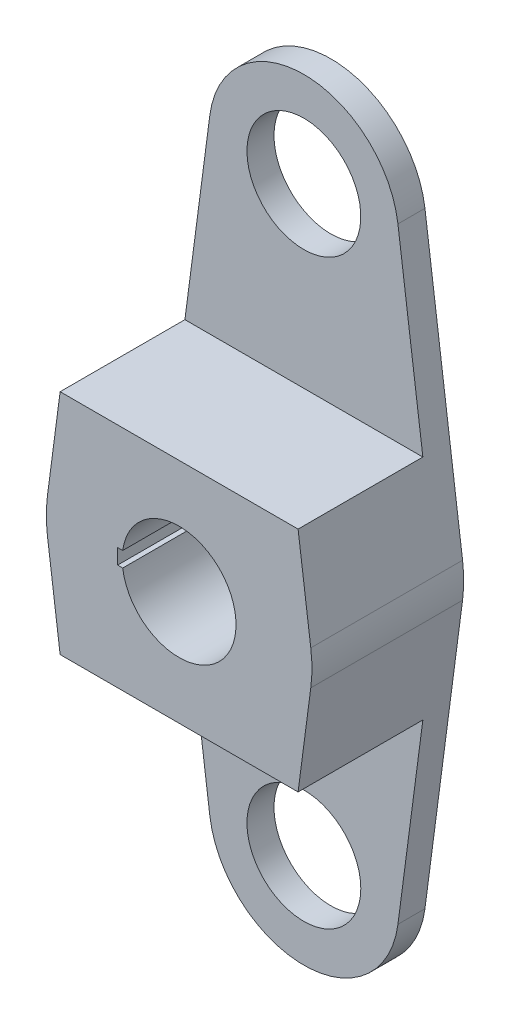
from build123d import *
from build123d.topology import SkipClean

# Parameters (mm, degrees)
BOSS_EXTRUDE1_DEPTH = 3.175
BOSS_EXTRUDE2_START = 3.175
SKETCH2_R           = 3.175
BOSS_EXTRUDE2_DEPTH = 3.175
SKETCH3_R           = 4.7625
BOSS_EXTRUDE3_DEPTH = 6.35
BOSS_EXTRUDE4_START = 3.175
SKETCH4_R           = 4.7625
BOSS_EXTRUDE4_DEPTH = 3.175
CUT_EXTRUDE1_START  = -4.0894
CUT_EXTRUDE1_DEPTH  = 4.0894
SKETCH6_W           = 0.762
SKETCH6_H           = 1.27
CUT_EXTRUDE2_DEPTH  = 9.525


with BuildPart() as part:
    # Sketch1 → Boss-Extrude1 (new body)
    with BuildSketch(Plane.XY):
        with BuildLine():
            Line((11.017558073, 1.449506939), (7.869684338, 25.3761821))
            ThreePointArc((7.869684338, 25.3761821), (7.920527939, 24.859610334), (7.9375, 24.34082))
            ThreePointArc((7.9375, 24.34082), (5.612660076, 18.728159924), (0, 16.40332))
            Line((0, 16.40332), (0, 11.1125))
            ThreePointArc((0, 11.1125), (7.327346395, 8.354498851), (11.017558073, 1.449506939))
        make_face()
        with BuildLine():
            ThreePointArc((7.9375, 24.34082), (7.920527939, 24.859610334), (7.869684338, 25.3761821))
            ThreePointArc((7.869684338, 25.3761821), (5.233818854, 30.30831918), (0, 32.27832))
            Line((0, 32.27832), (0, 29.10332))
            ThreePointArc((0, 29.10332), (3.367596045, 27.708416045), (4.7625, 24.34082))
            ThreePointArc((4.7625, 24.34082), (3.367596045, 20.973223955), (0, 19.57832))
            Line((0, 19.57832), (0, 16.40332))
            ThreePointArc((0, 16.40332), (5.612660076, 18.728159924), (7.9375, 24.34082))
        make_face()
        with BuildLine():
            Line((0, 29.10332), (0, 32.27832))
            ThreePointArc((0, 32.27832), (-5.233818854, 30.30831918), (-7.869684338, 25.3761821))
            ThreePointArc((-7.869684338, 25.3761821), (-5.96749918, 19.107001146), (0, 16.40332))
            Line((0, 16.40332), (0, 19.57832))
            ThreePointArc((0, 19.57832), (-4.7625, 24.34082), (0, 29.10332))
        make_face()
        with BuildLine():
            ThreePointArc((-11.017558073, 1.449506939), (-7.327346395, 8.354498851), (0, 11.1125))
            Line((0, 11.1125), (0, 16.40332))
            ThreePointArc((0, 16.40332), (-5.96749918, 19.107001146), (-7.869684338, 25.3761821))
            Line((-7.869684338, 25.3761821), (-11.017558073, 1.449506939))
        make_face()
        with BuildLine():
            ThreePointArc((11.1125, 0), (11.088739115, 0.726306467), (11.017558073, 1.449506939))
            ThreePointArc((11.017558073, 1.449506939), (7.327346395, 8.354498851), (0, 11.1125))
            Line((0, 11.1125), (0, 4.7625))
            ThreePointArc((0, 4.7625), (3.367596045, 3.367596045), (4.7625, 0))
            ThreePointArc((4.7625, 0), (3.367596045, -3.367596045), (0, -4.7625))
            Line((0, -4.7625), (0, -11.1125))
            ThreePointArc((0, -11.1125), (7.327346395, -8.354498851), (11.017558073, -1.449506939))
            ThreePointArc((11.017558073, -1.449506939), (11.088739115, -0.726306467), (11.1125, 0))
        make_face()
        with BuildLine():
            Line((0, 4.7625), (0, 11.1125))
            ThreePointArc((0, 11.1125), (-7.327346395, 8.354498851), (-11.017558073, 1.449506939))
            ThreePointArc((-11.017558073, 1.449506939), (-11.1125, 0), (-11.017558073, -1.449506939))
            ThreePointArc((-11.017558073, -1.449506939), (-7.327346395, -8.354498851), (0, -11.1125))
            Line((0, -11.1125), (0, -4.7625))
            ThreePointArc((0, -4.7625), (-4.7625, 0), (0, 4.7625))
        make_face()
        with BuildLine():
            Line((7.869684338, -25.3761821), (11.017558073, -1.449506939))
            ThreePointArc((11.017558073, -1.449506939), (7.327346395, -8.354498851), (0, -11.1125))
            Line((0, -11.1125), (0, -16.40332))
            ThreePointArc((0, -16.40332), (5.612660076, -18.728159924), (7.9375, -24.34082))
            ThreePointArc((7.9375, -24.34082), (7.920527939, -24.859610334), (7.869684338, -25.3761821))
        make_face()
        with BuildLine():
            Line((0, -16.40332), (0, -11.1125))
            ThreePointArc((0, -11.1125), (-7.327346395, -8.354498851), (-11.017558073, -1.449506939))
            Line((-11.017558073, -1.449506939), (-7.869684338, -25.3761821))
            ThreePointArc((-7.869684338, -25.3761821), (-5.96749918, -19.107001146), (0, -16.40332))
        make_face()
        with BuildLine():
            ThreePointArc((0, -32.27832), (5.233818854, -30.30831918), (7.869684338, -25.3761821))
            ThreePointArc((7.869684338, -25.3761821), (7.920527939, -24.859610334), (7.9375, -24.34082))
            ThreePointArc((7.9375, -24.34082), (5.612660076, -18.728159924), (0, -16.40332))
            Line((0, -16.40332), (0, -19.57832))
            ThreePointArc((0, -19.57832), (3.367596045, -20.973223955), (4.7625, -24.34082))
            ThreePointArc((4.7625, -24.34082), (3.367596045, -27.708416045), (0, -29.10332))
            Line((0, -29.10332), (0, -32.27832))
        make_face()
        with BuildLine():
            ThreePointArc((-7.869684338, -25.3761821), (-5.233818854, -30.30831918), (0, -32.27832))
            Line((0, -32.27832), (0, -29.10332))
            ThreePointArc((0, -29.10332), (-4.7625, -24.34082), (0, -19.57832))
            Line((0, -19.57832), (0, -16.40332))
            ThreePointArc((0, -16.40332), (-5.96749918, -19.107001146), (-7.869684338, -25.3761821))
        make_face()
    extrude(amount=BOSS_EXTRUDE1_DEPTH)

    # Sketch2 → Boss-Extrude2 (add)
    with BuildSketch(Plane(origin=(0, 0, 0), x_dir=(-1, 0, 0), z_dir=(0, 0, -1)).offset(BOSS_EXTRUDE2_START)):
        with BuildLine():
            Line((-9.955119086, 9.525), (9.955119086, 9.525))
            Line((9.955119086, 9.525), (11.017558073, 1.449506939))
            ThreePointArc((11.017558073, 1.449506939), (11.1125, 0), (11.017558073, -1.449506939))
            Line((11.017558073, -1.449506939), (9.955119086, -9.525))
            Line((9.955119086, -9.525), (-9.955119086, -9.525))
            Line((-9.955119086, -9.525), (-11.017558073, -1.449506939))
            ThreePointArc((-11.017558073, -1.449506939), (-11.1125, 0), (-11.017558073, 1.449506939))
            Line((-11.017558073, 1.449506939), (-9.955119086, 9.525))
        make_face()
        Circle(SKETCH2_R, mode=Mode.SUBTRACT)
    extrude(amount=-BOSS_EXTRUDE2_DEPTH)

    # Sketch3 → Boss-Extrude3 (add)
    with SkipClean():  # the faces are left unmerged after this step: merging them gives an invalid solid
        with BuildSketch(Plane.XY.offset(3.175)):
            with BuildLine():
                Line((-9.955119086, 9.525), (9.955119086, 9.525))
                Line((9.955119086, 9.525), (11.017558073, 1.449506939))
                ThreePointArc((11.017558073, 1.449506939), (11.1125, 0), (11.017558073, -1.449506939))
                Line((11.017558073, -1.449506939), (9.955119086, -9.525))
                Line((9.955119086, -9.525), (-9.955119086, -9.525))
                Line((-9.955119086, -9.525), (-11.017558073, -1.449506939))
                ThreePointArc((-11.017558073, -1.449506939), (-11.1125, 0), (-11.017558073, 1.449506939))
                Line((-11.017558073, 1.449506939), (-9.955119086, 9.525))
            make_face()
            Circle(SKETCH3_R, mode=Mode.SUBTRACT)
        extrude(amount=BOSS_EXTRUDE3_DEPTH)

    # Sketch4 → Boss-Extrude4 (add)
    # profile 1 of 2: a face of its own
    with SkipClean():  # the faces are left unmerged after this step: merging them gives an invalid solid
        with BuildSketch(Plane(origin=(0, 0, 0), x_dir=(-1, 0, 0), z_dir=(0, 0, -1)).offset(BOSS_EXTRUDE4_START)):
            with BuildLine():
                Line((9.955119086, 9.525), (-9.955119086, 9.525))
                Line((-9.955119086, 9.525), (-7.869684338, 25.3761821))
                ThreePointArc((-7.869684338, 25.3761821), (0, 32.27832), (7.869684338, 25.3761821))
                Line((7.869684338, 25.3761821), (9.955119086, 9.525))
            make_face()
            with Locations(Location((0, 24.34082, 0), (0, 0, 180))):
                Circle(SKETCH4_R, mode=Mode.SUBTRACT)
        # profile 2 of 2: a face of its own
        with BuildSketch(Plane(origin=(0, 0, 0), x_dir=(-1, 0, 0), z_dir=(0, 0, -1)).offset(BOSS_EXTRUDE4_START)):
            with BuildLine():
                Line((-9.955119086, -9.525), (-7.869684338, -25.3761821))
                ThreePointArc((-7.869684338, -25.3761821), (0, -32.27832), (7.869684338, -25.3761821))
                Line((7.869684338, -25.3761821), (9.955119086, -9.525))
                Line((9.955119086, -9.525), (-9.955119086, -9.525))
            make_face()
            with Locations(Location((0, -24.34082, 0), (0, 0, 180))):
                Circle(SKETCH4_R, mode=Mode.SUBTRACT)
        extrude(amount=-BOSS_EXTRUDE4_DEPTH)

    # Sketch5 → Cut-Extrude1 (cut)
    with SkipClean():  # the faces are left unmerged after this step: merging them gives an invalid solid
        with BuildSketch(Plane.XY.offset(3.175).offset(CUT_EXTRUDE1_START)):
            with BuildLine():
                Line((-7.869684338, -25.3761821), (-9.955119086, -9.525))
                Line((-9.955119086, -9.525), (9.955119086, -9.525))
                Line((9.955119086, -9.525), (7.869684338, -25.3761821))
                ThreePointArc((7.869684338, -25.3761821), (0, -32.27832), (-7.869684338, -25.3761821))
            make_face()
            with BuildLine():
                Line((-7.869684338, 25.3761821), (-9.955119086, 9.525))
                Line((-9.955119086, 9.525), (9.955119086, 9.525))
                Line((9.955119086, 9.525), (7.869684338, 25.3761821))
                ThreePointArc((7.869684338, 25.3761821), (0, 32.27832), (-7.869684338, 25.3761821))
            make_face()
        extrude(amount=CUT_EXTRUDE1_DEPTH, mode=Mode.SUBTRACT)

    # Sketch6 → Cut-Extrude2 (cut)
    with SkipClean():  # the faces are left unmerged after this step: merging them gives an invalid solid
        with BuildSketch(Plane.XY.offset(9.525)):
            with Locations((-4.7625, 0)):
                Rectangle(SKETCH6_W, SKETCH6_H)
        extrude(amount=-CUT_EXTRUDE2_DEPTH, mode=Mode.SUBTRACT)


solid = part.part
